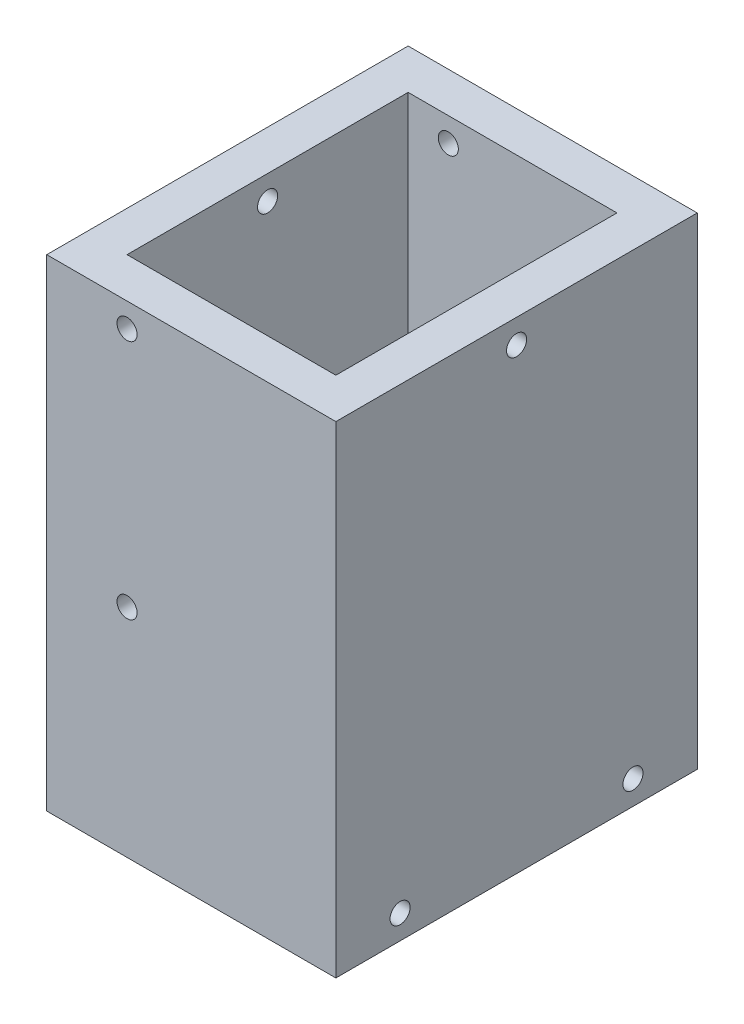
from build123d import *

# Parameters (mm, degrees)
SKETCH_1_W          = 36
SKETCH_1_H          = 45
SKETCH_1_W_2        = 26
SKETCH_1_H_2        = 35
EXTRUDE_1_DEPTH     = 60
SKETCH_4_R          = 1.25
CUT_EXTRUDE_1_DEPTH = 74.5
SKETCH_5_R          = 1.25
CUT_EXTRUDE_2_DEPTH = 78.129760793
SKETCH_6_R          = 1.25
CUT_EXTRUDE_3_DEPTH = 74.5


with BuildPart() as part:
    # 草图1 → 凸台-拉伸1 (new body)
    with BuildSketch(Plane(origin=(0, 0, 0), x_dir=(1, 0, 0), z_dir=(0, 1, 0))):
        Rectangle(SKETCH_1_W, SKETCH_1_H)
        Rectangle(SKETCH_1_W_2, SKETCH_1_H_2, mode=Mode.SUBTRACT)
    extrude(amount=EXTRUDE_1_DEPTH)

    # 草图4 → 切除-拉伸1 (cut, through all)
    with BuildSketch(Plane.ZY.offset(18)):
        with Locations((14.5, 3)):
            Circle(SKETCH_4_R)
        with Locations((-14.5, 3)):
            Circle(SKETCH_4_R)
    extrude(amount=-CUT_EXTRUDE_1_DEPTH, mode=Mode.SUBTRACT)

    # 草图5 → 切除-拉伸2 (cut, through all)
    with BuildSketch(Plane.XY.offset(22.5)):
        with Locations((-8, 57)):
            Circle(SKETCH_5_R)
        with Locations((-8, 27)):
            Circle(SKETCH_5_R)
    extrude(amount=-CUT_EXTRUDE_2_DEPTH, mode=Mode.SUBTRACT)

    # 草图6 → 切除-拉伸3 (cut, through all)
    with BuildSketch(Plane(origin=(18, 0, 0), x_dir=(0, 0, -1), z_dir=(1, 0, 0))):
        with Locations((0, 57)):
            Circle(SKETCH_6_R)
    extrude(amount=-CUT_EXTRUDE_3_DEPTH, mode=Mode.SUBTRACT)


solid = part.part
